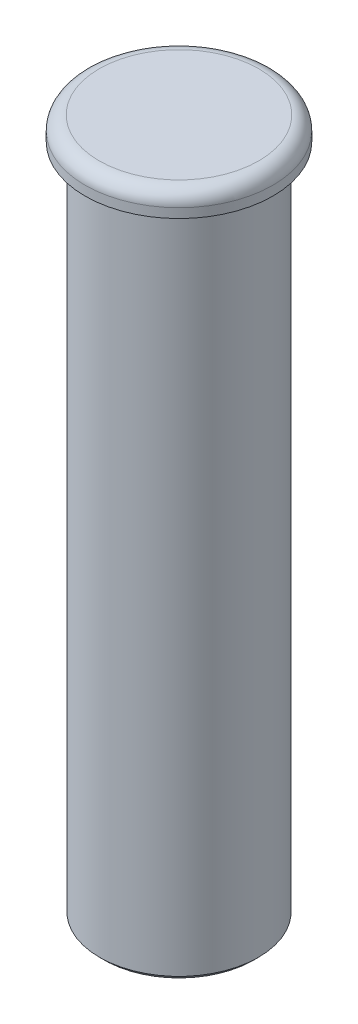
from build123d import *

# Parameters (mm, degrees)
RACCORDO1_R  = 1.5
RACCORDO2_R  = 0.5
SMUSSO1_SIZE = 0.5


with BuildPart() as part:
    # Schizzo1 → Rivoluzione1 (revolve)
    with BuildSketch(Plane.XY, mode=Mode.PRIVATE) as rivoluzione1_sk:
        Polygon((-10, 37), (0, 37), (0, -37), (-8.45, -37), (-8.45, 34.5), (-10, 34.5), align=None)
    revolve(rivoluzione1_sk.sketch.rotate(Axis((0, 37, 0), (0, -1, 0)), 270), axis=Axis((0, 37, 0), (0, -1, 0)))

    # Raccordo1
    raccordo1_edges = [part.edges().sort_by_distance(p)[0] for p in [
        (0, 37, -10),
    ]]
    fillet(raccordo1_edges, radius=RACCORDO1_R)

    # Raccordo2
    raccordo2_edges = [part.edges().sort_by_distance(p)[0] for p in [
        (0, 34.5, -8.45),
    ]]
    fillet(raccordo2_edges, radius=RACCORDO2_R)

    # Smusso1
    smusso1_edges = [part.edges().sort_by_distance(p)[0] for p in [
        (0, -37, -8.45),
    ]]
    chamfer(smusso1_edges, length=SMUSSO1_SIZE)


solid = part.part
